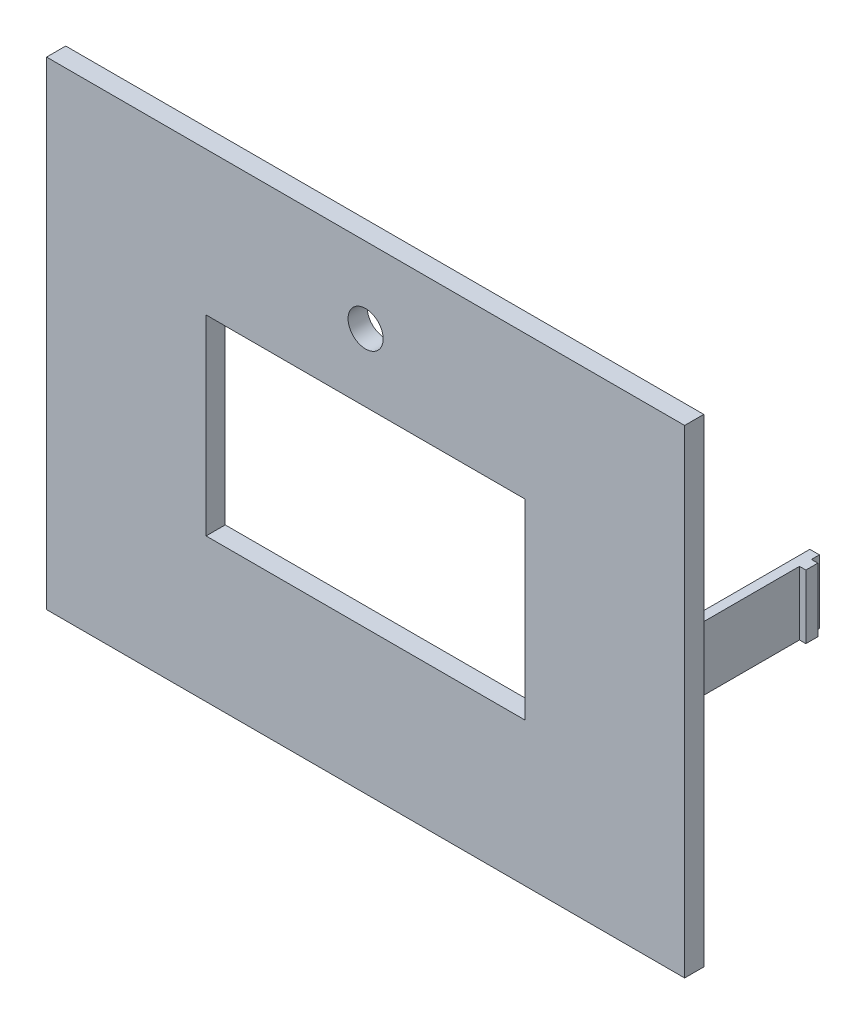
from build123d import *

# Parameters (mm, degrees)
SKETCH2_W                  = 80
SKETCH2_H                  = 60
SKETCH2_W_2                = 40
SKETCH2_H_2                = 24
LID_FRAME_DEPTH            = 2.4
SNAP_LEFT_START            = -18
SKETCH3_W                  = 1.2
SKETCH3_H                  = 8
SNAP_LEFT_DEPTH            = 18
SNAP_RIGHT_START           = -18
SKETCH4_W                  = 1.2
SKETCH4_H                  = 8
SNAP_RIGHT_DEPTH           = 18
HOOK_LEFT_START            = -17
SKETCH5_W                  = 0.8
SKETCH5_H                  = 8
HOOK_LEFT_DEPTH            = 1.5
HOOK_RIGHT_START           = -17
SKETCH6_W                  = 0.8
SKETCH6_H                  = 8
HOOK_RIGHT_DEPTH           = 1.5
SKETCH8_R                  = 2.2
SHAFT_CLEARANCE_D4P4_DEPTH = 54.141321022


with BuildPart() as part:
    # Sketch2 → Lid_frame (new body)
    with BuildSketch(Plane.XY):
        Rectangle(SKETCH2_W, SKETCH2_H)
        Rectangle(SKETCH2_W_2, SKETCH2_H_2, mode=Mode.SUBTRACT)
    extrude(amount=LID_FRAME_DEPTH)

    # Sketch3 → Snap_left (add)
    with BuildSketch(Plane.XY.offset(SNAP_LEFT_START)):
        with Locations((-35.9, 0)):
            Rectangle(SKETCH3_W, SKETCH3_H)
    extrude(amount=SNAP_LEFT_DEPTH)

    # Sketch4 → Snap_right (add)
    with BuildSketch(Plane.XY.offset(SNAP_RIGHT_START)):
        with Locations((35.9, 0)):
            Rectangle(SKETCH4_W, SKETCH4_H)
    extrude(amount=SNAP_RIGHT_DEPTH)

    # Sketch5 → Hook_left (add)
    with BuildSketch(Plane.XY.offset(HOOK_LEFT_START)):
        with Locations((-36.9, 0)):
            Rectangle(SKETCH5_W, SKETCH5_H)
    extrude(amount=HOOK_LEFT_DEPTH)

    # Sketch6 → Hook_right (add)
    with BuildSketch(Plane.XY.offset(HOOK_RIGHT_START)):
        with Locations((36.9, 0)):
            Rectangle(SKETCH6_W, SKETCH6_H)
    extrude(amount=HOOK_RIGHT_DEPTH)

    # Sketch8 → Shaft_clearance_D4p4 (cut, through all)
    with BuildSketch(Plane.XY):
        with Locations((0, 20.5)):
            Circle(SKETCH8_R)
    extrude(amount=SHAFT_CLEARANCE_D4P4_DEPTH, mode=Mode.SUBTRACT)


solid = part.part
